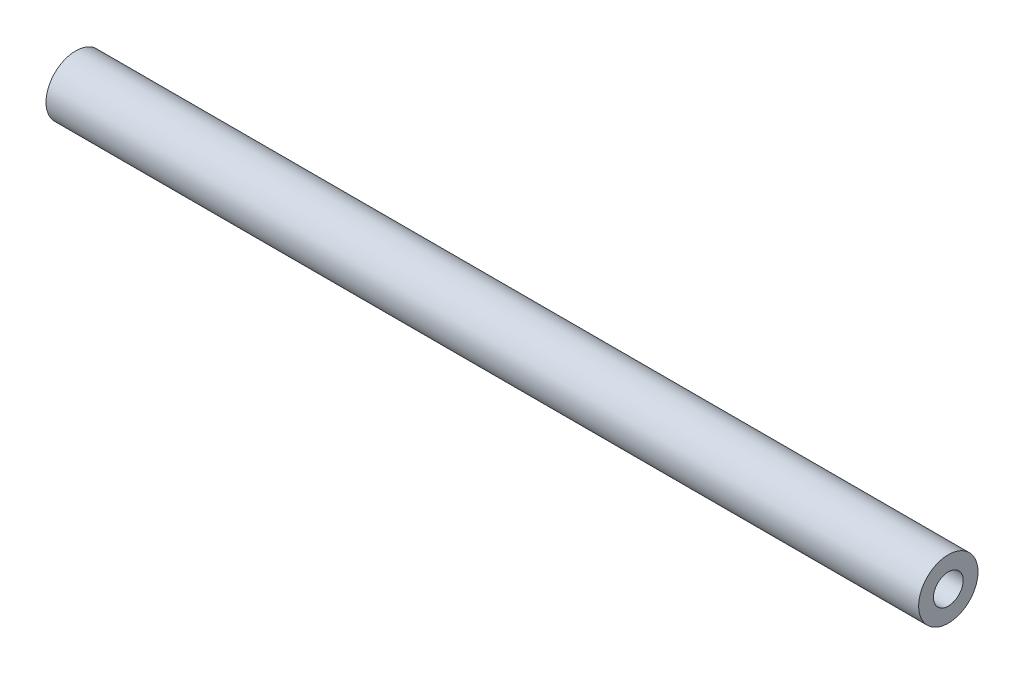
from build123d import *

# Parameters (mm, degrees)
BOSS_EXTRUDE1_DEPTH      = 127
BOSS_EXTRUDE1_DEPTH_BACK = 127
SKETCH1_R                = 10
SKETCH2_R                = 10
SKETCH2_R_2              = 5
BOSS_EXTRUDE2_DEPTH      = 20
BOSS_EXTRUDE3_START      = 20
SKETCH3_R                = 10
SKETCH3_R_2              = 5
BOSS_EXTRUDE3_DEPTH      = 20


with BuildPart() as part:
    # Sketch1 → Boss-Extrude1 (new, two sides: drawn at the far end of the back side and taken through both)
    with BuildSketch(Plane(origin=(0, 0, 0), x_dir=(0, 0, -1), z_dir=(1, 0, 0)).offset(-BOSS_EXTRUDE1_DEPTH_BACK)):
        Circle(SKETCH1_R)
    extrude(amount=BOSS_EXTRUDE1_DEPTH + BOSS_EXTRUDE1_DEPTH_BACK)

    # Sketch2 → Boss-Extrude2 (add)
    with BuildSketch(Plane(origin=(127, 0, 0), x_dir=(0, 0, -1), z_dir=(1, 0, 0))):
        Circle(SKETCH2_R)
        Circle(SKETCH2_R_2, mode=Mode.SUBTRACT)
    extrude(amount=BOSS_EXTRUDE2_DEPTH)

    # Sketch3 → Boss-Extrude3 (add)
    with BuildSketch(Plane.ZY.offset(127).offset(BOSS_EXTRUDE3_START)):
        Circle(SKETCH3_R)
        Circle(SKETCH3_R_2, mode=Mode.SUBTRACT)
    extrude(amount=-BOSS_EXTRUDE3_DEPTH)


solid = part.part
